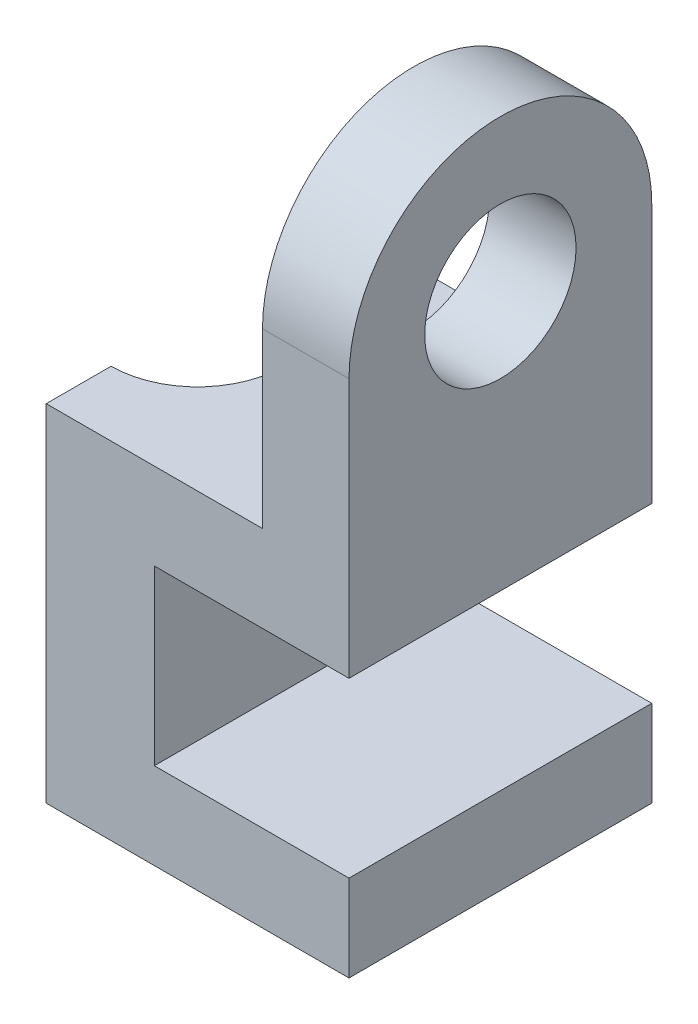
from build123d import *

# Parameters (mm, degrees)
SKETCH1_W               = 70
SKETCH1_H               = 80
BOSS_EXTRUDE1_DEPTH     = 70
SKETCH2_W               = 45
SKETCH2_H               = 40
CUT_EXTRUDE1_DEPTH      = 70
CUT_EXTRUDE2_DEPTH      = 112.915146428
CUT_EXTRUDE2_DEPTH_BACK = 112.915146428
BOSS_EXTRUDE2_DEPTH     = 20
SKETCH5_R               = 17.5
CUT_EXTRUDE3_DEPTH      = 20


with BuildPart() as part:
    # Sketch1 → Boss-Extrude1 (new body)
    with BuildSketch(Plane.XY):
        Rectangle(SKETCH1_W, SKETCH1_H)
    extrude(amount=BOSS_EXTRUDE1_DEPTH)

    # Sketch2 → Cut-Extrude1 (cut)
    with BuildSketch(Plane.XY.offset(70)):
        with Locations((12.5, 0)):
            Rectangle(SKETCH2_W, SKETCH2_H)
    extrude(amount=-CUT_EXTRUDE1_DEPTH, mode=Mode.SUBTRACT)

    # Sketch3 → Cut-Extrude2 (cut, two sides: drawn at the far end of the back side and taken through both)
    with BuildSketch(Plane(origin=(0, 40, 0), x_dir=(1, 0, 0), z_dir=(0, 1, 0)).offset(-CUT_EXTRUDE2_DEPTH_BACK)):
        with BuildLine():
            Line((-35, -55), (-35, -15))
            ThreePointArc((-35, -15), (-15, -35), (-35, -55))
        make_face()
    extrude(amount=CUT_EXTRUDE2_DEPTH + CUT_EXTRUDE2_DEPTH_BACK, mode=Mode.SUBTRACT)

    # Sketch4 → Boss-Extrude2 (add)
    with BuildSketch(Plane(origin=(35, 0, 0), x_dir=(0, 0, -1), z_dir=(1, 0, 0))):
        with BuildLine():
            Line((-70, 40), (-70, 80))
            ThreePointArc((-70, 80), (-35, 115), (0, 80))
            Line((0, 80), (0, 40))
            Line((0, 40), (-70, 40))
        make_face()
    extrude(amount=-BOSS_EXTRUDE2_DEPTH)

    # Sketch5 → Cut-Extrude3 (cut)
    with BuildSketch(Plane(origin=(35, 0, 0), x_dir=(0, 0, -1), z_dir=(1, 0, 0))):
        with Locations((-35, 80)):
            Circle(SKETCH5_R)
    extrude(amount=-CUT_EXTRUDE3_DEPTH, mode=Mode.SUBTRACT)


solid = part.part
